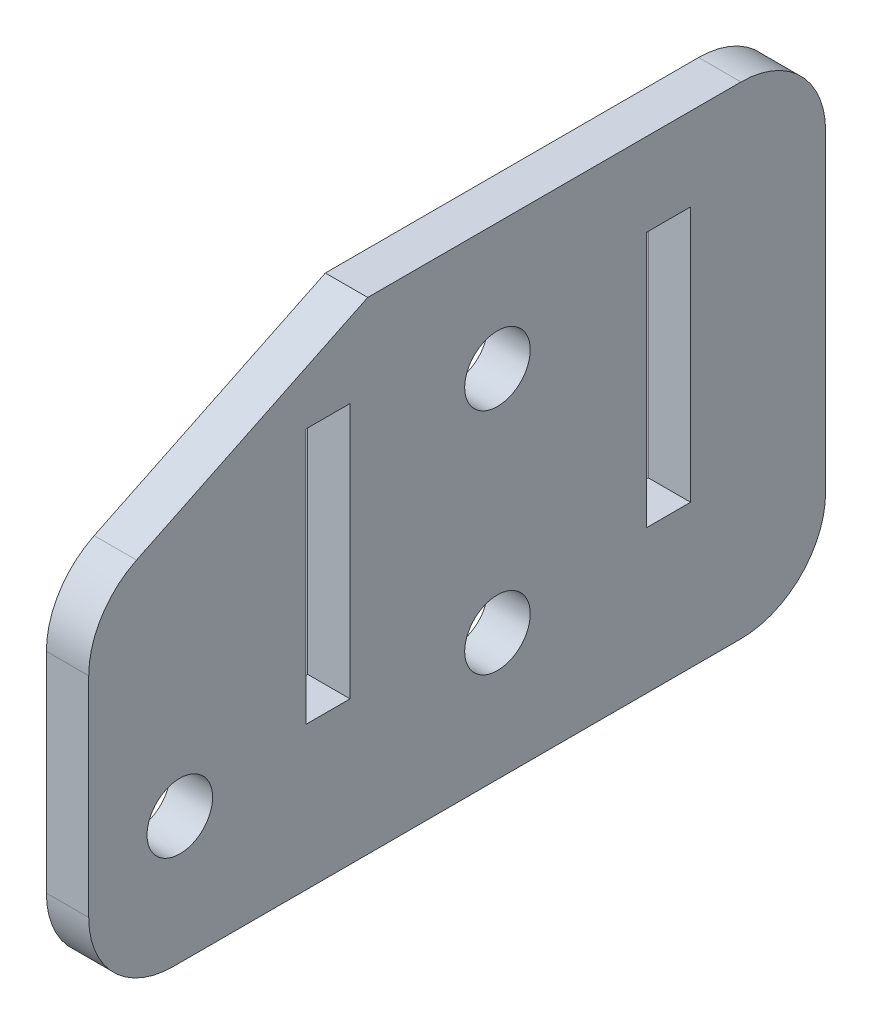
from build123d import *

# Parameters (mm, degrees)
BOSS_EXTRUDE1_DEPTH              = 3.175
SKETCH7_W                        = 3.302
SKETCH7_H                        = 19.177
CUT_EXTRUDE1_DEPTH               = 3.175
FILLET1_R                        = 6.35
F_10_0_1935_DIAMETER_HOLE2_D     = 4.9149
F_10_0_1935_DIAMETER_HOLE2_DEPTH = 9.699415072
F_10_0_1935_DIAMETER_HOLE2_TIP   = 1.476584928


with BuildPart() as part:
    # Sketch1 → Boss-Extrude1 (new body)
    with BuildSketch(Plane(origin=(0, 0, 0), x_dir=(0, 0, -1), z_dir=(1, 0, 0))):
        Polygon((55.245, 0), (55.245, 36.15436), (20.9147283, 36.15436), (0, 26.034021846), (0, 0), align=None)
    extrude(amount=BOSS_EXTRUDE1_DEPTH)

    # Sketch7 → Cut-Extrude1 (cut)
    with BuildSketch(Plane.ZY):
        with Locations((-43.469153092, 20.34286)):
            Rectangle(SKETCH7_W, SKETCH7_H)
        with Locations((-17.942153092, 20.34286)):
            Rectangle(SKETCH7_W, SKETCH7_H)
    extrude(amount=-CUT_EXTRUDE1_DEPTH, mode=Mode.SUBTRACT)

    # Fillet1
    fillet1_edges = [part.edges().sort_by_distance(p)[0] for p in [
        (1.5875, 0, 0),
        (1.5875, 26.034021846, 0),
        (1.5875, 36.15436, -55.245),
        (1.5875, 0, -55.245),
    ]]
    fillet(fillet1_edges, radius=FILLET1_R)

    # #10 (0.1935) Diameter Hole2
    with Locations(Plane.ZY):
        with Locations((-30.642153092, 9.525), (-30.642153092, 26.67), (-6.829653092, 9.525)):
            Hole(F_10_0_1935_DIAMETER_HOLE2_D / 2, depth=F_10_0_1935_DIAMETER_HOLE2_DEPTH)
            with Locations((0, 0, -(F_10_0_1935_DIAMETER_HOLE2_DEPTH + F_10_0_1935_DIAMETER_HOLE2_TIP / 2))):  # 118° drill point
                Cone(0, F_10_0_1935_DIAMETER_HOLE2_D / 2, F_10_0_1935_DIAMETER_HOLE2_TIP, mode=Mode.SUBTRACT)


solid = part.part
